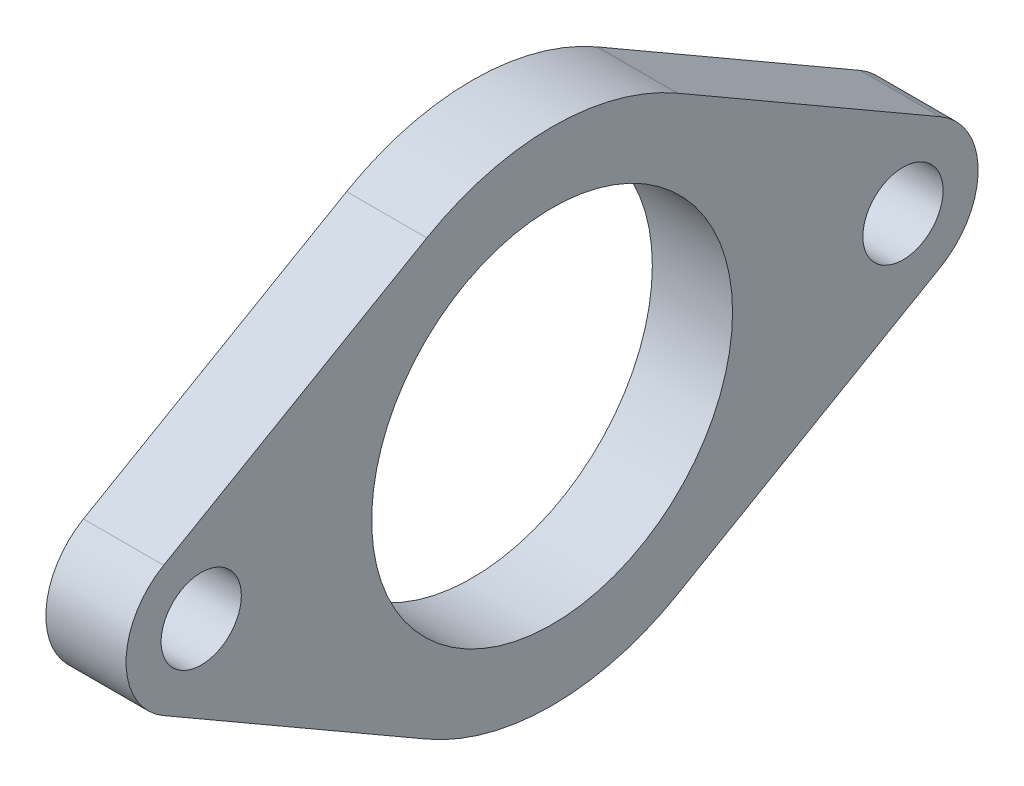
from build123d import *

# Parameters (mm, degrees)
SKETCH1_R           = 4
SKETCH1_R_2         = 18
BOSS_EXTRUDE1_DEPTH = 8


with BuildPart() as part:
    # Sketch1 → Boss-Extrude1 (new body)
    with BuildSketch(Plane(origin=(0, 0, 0), x_dir=(0, 0, -1), z_dir=(1, 0, 0))):
        with BuildLine():
            ThreePointArc((-38.75, 6.495190528), (-42.5, 0), (-38.75, -6.495190528))
            Line((-38.75, -6.495190528), (-12.5, -21.650635095))
            ThreePointArc((-12.5, -21.650635095), (0, -25), (12.5, -21.650635095))
            Line((12.5, -21.650635095), (38.75, -6.495190528))
            ThreePointArc((38.75, -6.495190528), (42.5, 0), (38.75, 6.495190528))
            Line((38.75, 6.495190528), (12.5, 21.650635095))
            ThreePointArc((12.5, 21.650635095), (0, 25), (-12.5, 21.650635095))
            Line((-12.5, 21.650635095), (-38.75, 6.495190528))
        make_face()
        with Locations((-35, 0)):
            Circle(SKETCH1_R, mode=Mode.SUBTRACT)
        Circle(SKETCH1_R_2, mode=Mode.SUBTRACT)
        with Locations((35, 0)):
            Circle(SKETCH1_R, mode=Mode.SUBTRACT)
    extrude(amount=BOSS_EXTRUDE1_DEPTH)


solid = part.part
